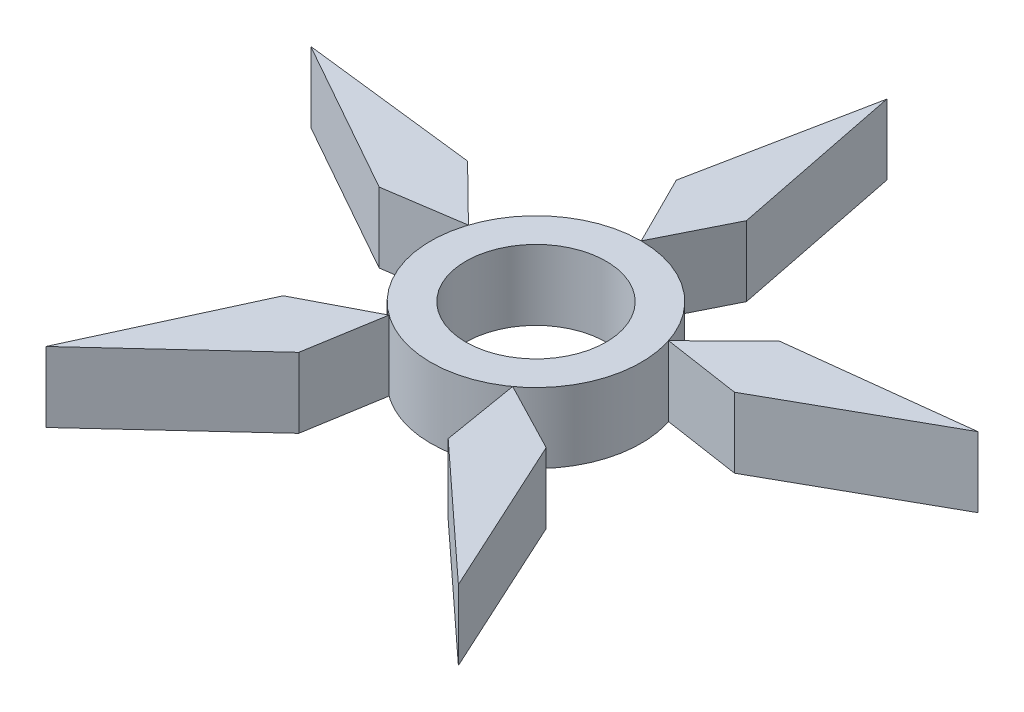
from build123d import *

# Parameters (mm, degrees)
SKETCH1_R           = 1.5
SKETCH1_R_2         = 1
BOSS_EXTRUDE2_DEPTH = 1
BOSS_EXTRUDE3_DEPTH = 1
CIRPATTERN9_COUNT   = 5


with BuildPart() as part:
    # Sketch1 → Boss-Extrude2 (new body)
    with BuildSketch(Plane(origin=(0, 0, 0), x_dir=(1, 0, 0), z_dir=(0, 1, 0))):
        Circle(SKETCH1_R)
        Circle(SKETCH1_R_2, mode=Mode.SUBTRACT)
    extrude(amount=BOSS_EXTRUDE2_DEPTH)


with BuildPart() as body_2:
    # Sketch2 → Boss-Extrude3 (new body)
    with BuildSketch(Plane(origin=(0, 0, 0), x_dir=(1, 0, 0), z_dir=(0, 1, 0))):
        Polygon((0, 1.5), (-0.5, 2.5), (0, 5), (0.5, 2.5), align=None)
    extrude(amount=BOSS_EXTRUDE3_DEPTH)


with BuildPart() as cirpattern9_1:
    # CirPattern9: pattern copy
    add(body_2.part.rotate(Axis((0, 1, 0), (0, -1, 0)), 1 * 360 / CIRPATTERN9_COUNT))


with BuildPart() as cirpattern9_2:
    # CirPattern9: pattern copy
    add(body_2.part.rotate(Axis((0, 1, 0), (0, -1, 0)), 2 * 360 / CIRPATTERN9_COUNT))


with BuildPart() as cirpattern9_3:
    # CirPattern9: pattern copy
    add(body_2.part.rotate(Axis((0, 1, 0), (0, -1, 0)), 3 * 360 / CIRPATTERN9_COUNT))


with BuildPart() as cirpattern9_4:
    # CirPattern9: pattern copy
    add(body_2.part.rotate(Axis((0, 1, 0), (0, -1, 0)), 4 * 360 / CIRPATTERN9_COUNT))


solid = Compound([part.part, body_2.part, cirpattern9_1.part, cirpattern9_2.part, cirpattern9_3.part, cirpattern9_4.part])
